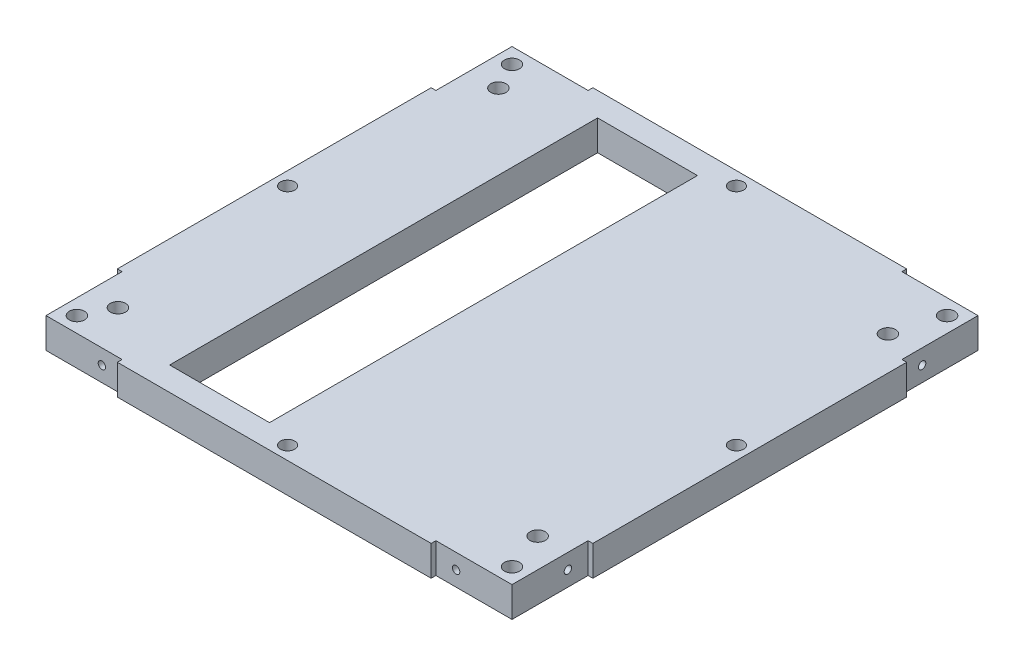
from build123d import *

# Parameters (mm, degrees)
BOSS_EXTRUDE1_DEPTH = 6.35
SKETCH4_R           = 1.2
CUT_EXTRUDE3_DEPTH  = 2540
SKETCH129_R         = 0.775
CUT_EXTRUDE5_DEPTH  = 3
SKETCH130_R         = 0.775
CUT_EXTRUDE6_DEPTH  = 8
CUT_EXTRUDE7_START  = -8
SKETCH131_R         = 0.775
CUT_EXTRUDE7_DEPTH  = 8
CUT_EXTRUDE8_START  = -8
SKETCH132_R         = 0.775
CUT_EXTRUDE8_DEPTH  = 8
SKETCH133_R         = 1.6
CUT_EXTRUDE9_DEPTH  = 10
SKETCH134_R         = 1.6
CUT_EXTRUDE10_DEPTH = 10
SKETCH135_R         = 1.5
CUT_EXTRUDE11_DEPTH = 142.56384602
SKETCH136_W         = 21
SKETCH136_H         = 90
CUT_EXTRUDE12_DEPTH = 142.56384602


with BuildPart() as part:
    # Sketch1 → Boss-Extrude1 (new body)
    with BuildSketch(Plane(origin=(0, 0, 0), x_dir=(1, 0, 0), z_dir=(0, 1, 0))):
        Polygon((1, 83), (0, 83), (0, 17), (1, 17), (1, 1), (17, 1), (17, 0), (83, 0), (83, 1), (99, 1), (99, 17), (100, 17), (100, 83), (99, 83), (99, 99), (83, 99), (83, 100), (17, 100), (17, 99), (1, 99), align=None)
    extrude(amount=BOSS_EXTRUDE1_DEPTH)

    # Sketch4 → Cut-Extrude3 (cut, symmetric)
    with BuildSketch(Plane(origin=(-170.766523355, -217.05420542, -269.308617799), x_dir=(0, 0, -1), z_dir=(0, -1, 0))):
        with Locations((-179.303617798, 177.901523357)):
            Circle(SKETCH4_R)
        with Locations((-259.313617798, 177.901523357)):
            Circle(SKETCH4_R)
        with Locations((-256.773617797, 263.631523357)):
            Circle(SKETCH4_R)
        with Locations((-183.113617797, 263.631523357)):
            Circle(SKETCH4_R)
    extrude(amount=CUT_EXTRUDE3_DEPTH, both=True, mode=Mode.SUBTRACT)

    # Sketch129 → Cut-Extrude5 (cut)
    with BuildSketch(Plane(origin=(99, 0, 0), x_dir=(0, 0, -1), z_dir=(1, 0, 0))):
        with Locations((12.75, 3.175)):
            Circle(SKETCH129_R)
        with Locations((87.25, 3.175)):
            Circle(SKETCH129_R)
    extrude(amount=-CUT_EXTRUDE5_DEPTH, mode=Mode.SUBTRACT)

    # Sketch130 → Cut-Extrude6 (cut)
    with BuildSketch(Plane.XY.offset(-1)):
        with Locations((87.25, 3.175)):
            Circle(SKETCH130_R)
        with Locations((12.75, 3.175)):
            Circle(SKETCH130_R)
    extrude(amount=-CUT_EXTRUDE6_DEPTH, mode=Mode.SUBTRACT)

    # Sketch131 → Cut-Extrude7 (cut)
    with BuildSketch(Plane.ZY.offset(-1).offset(CUT_EXTRUDE7_START)):
        with Locations(Location((-12.75, 3.175, 0), (0, 0, 180))):
            Circle(SKETCH131_R)
        with Locations(Location((-87.25, 3.175, 0), (0, 0, 180))):
            Circle(SKETCH131_R)
    extrude(amount=CUT_EXTRUDE7_DEPTH, mode=Mode.SUBTRACT)

    # Sketch132 → Cut-Extrude8 (cut)
    with BuildSketch(Plane(origin=(0, 0, -99), x_dir=(-1, 0, 0), z_dir=(0, 0, -1)).offset(CUT_EXTRUDE8_START)):
        with Locations(Location((-87.25, 3.175, 0), (0, 0, 180))):
            Circle(SKETCH132_R)
        with Locations(Location((-12.75, 3.175, 0), (0, 0, 180))):
            Circle(SKETCH132_R)
    extrude(amount=CUT_EXTRUDE8_DEPTH, mode=Mode.SUBTRACT)

    # Sketch133 → Cut-Extrude9 (cut)
    with BuildSketch(Plane(origin=(0, 6.35, 0), x_dir=(1, 0, 0), z_dir=(0, 1, 0))):
        with Locations(Location((4.25, 95.75, 0), (0, 0, 270))):
            Circle(SKETCH133_R)
        with Locations(Location((4.25, 4.25, 0), (0, 0, 270))):
            Circle(SKETCH133_R)
        with Locations(Location((95.75, 95.75, 0), (0, 0, 270))):
            Circle(SKETCH133_R)
        with Locations(Location((95.75, 4.25, 0), (0, 0, 270))):
            Circle(SKETCH133_R)
    extrude(amount=-CUT_EXTRUDE9_DEPTH, mode=Mode.SUBTRACT)

    # Sketch134 → Cut-Extrude10 (cut)
    with BuildSketch(Plane(origin=(0, 6.35, 0), x_dir=(1, 0, 0), z_dir=(0, 1, 0))):
        with Locations(Location((92.865000001, 86.195000002, 0), (0, 0, 270))):
            Circle(SKETCH134_R)
        with Locations(Location((92.865000002, 12.535000002, 0), (0, 0, 270))):
            Circle(SKETCH134_R)
        with Locations(Location((7.135000002, 9.995000001, 0), (0, 0, 270))):
            Circle(SKETCH134_R)
        with Locations(Location((7.135000001, 90.005000001, 0), (0, 0, 270))):
            Circle(SKETCH134_R)
    extrude(amount=-CUT_EXTRUDE10_DEPTH, mode=Mode.SUBTRACT)

    # Sketch135 → Cut-Extrude11 (cut, through all)
    with BuildSketch(Plane.XZ):
        with Locations(Location((2.8068, -50, 0), (0, 0, 270))):
            Circle(SKETCH135_R)
        with Locations(Location((50, -2.8068, 0), (0, 0, 270))):
            Circle(SKETCH135_R)
        with Locations(Location((97.1932, -50, 0), (0, 0, 270))):
            Circle(SKETCH135_R)
        with Locations(Location((50, -97.1932, 0), (0, 0, 270))):
            Circle(SKETCH135_R)
    extrude(amount=-CUT_EXTRUDE11_DEPTH, mode=Mode.SUBTRACT)

    # Sketch136 → Cut-Extrude12 (cut, through all)
    with BuildSketch(Plane.XZ):
        with Locations((33.5, -50)):
            Rectangle(SKETCH136_W, SKETCH136_H)
    extrude(amount=-CUT_EXTRUDE12_DEPTH, mode=Mode.SUBTRACT)


solid = part.part
